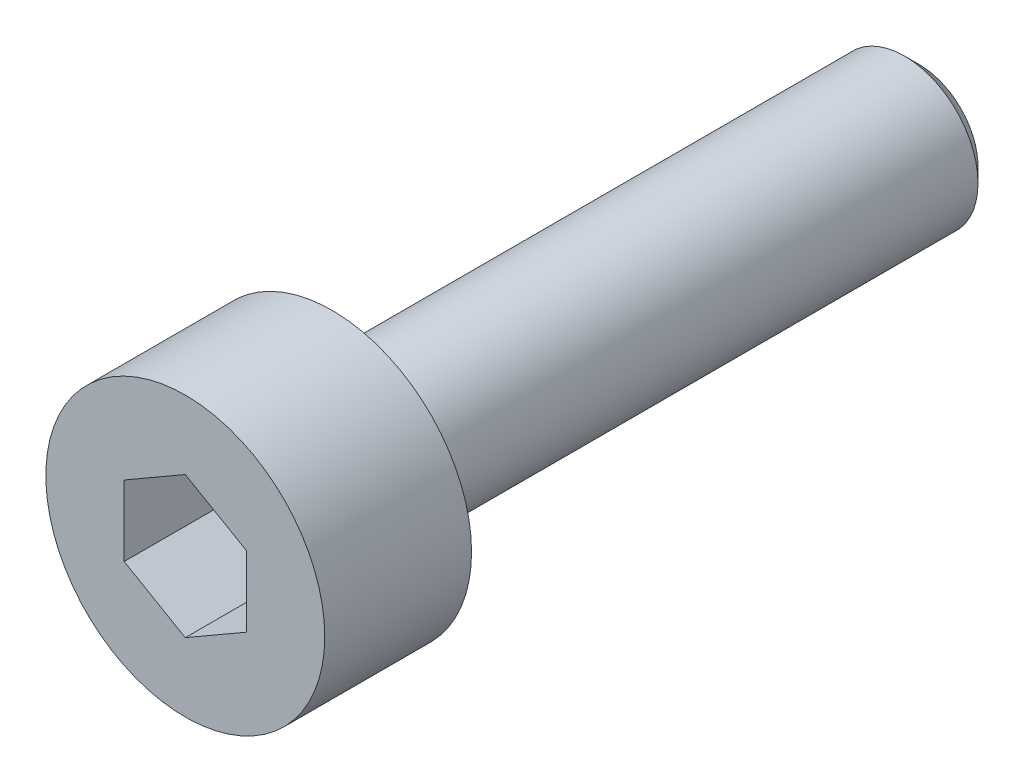
from build123d import *

# Parameters (mm, degrees)
SKETCH1_R           = 2.85
BOSS_EXTRUDE1_DEPTH = 3
SKETCH2_R           = 1.5
BOSS_EXTRUDE2_DEPTH = 12
CHAMFER1_SIZE       = 0.3
CUT_EXTRUDE1_DEPTH  = 2


with BuildPart() as part:
    # Sketch1 → Boss-Extrude1 (new body)
    with BuildSketch(Plane.XY):
        Circle(SKETCH1_R)
    extrude(amount=BOSS_EXTRUDE1_DEPTH)

    # Sketch2 → Boss-Extrude2 (add)
    with BuildSketch(Plane(origin=(0, 0, 0), x_dir=(-1, 0, 0), z_dir=(0, 0, -1))):
        with Locations(Location((0, 0, 0), (0, 0, 180))):
            Circle(SKETCH2_R)
    extrude(amount=BOSS_EXTRUDE2_DEPTH)

    # Chamfer1
    chamfer1_edges = [part.edges().sort_by_distance(p)[0] for p in [
        (-1.5, 0, -12),
    ]]
    chamfer(chamfer1_edges, length=CHAMFER1_SIZE)

    # Sketch3 → Cut-Extrude1 (cut)
    with BuildSketch(Plane.XY.offset(3)):
        Polygon((0, 1.443375673), (-1.25, 0.721687836), (-1.25, -0.721687836), (0, -1.443375673), (1.25, -0.721687836), (1.25, 0.721687836), align=None)
    extrude(amount=-CUT_EXTRUDE1_DEPTH, mode=Mode.SUBTRACT)


solid = part.part
